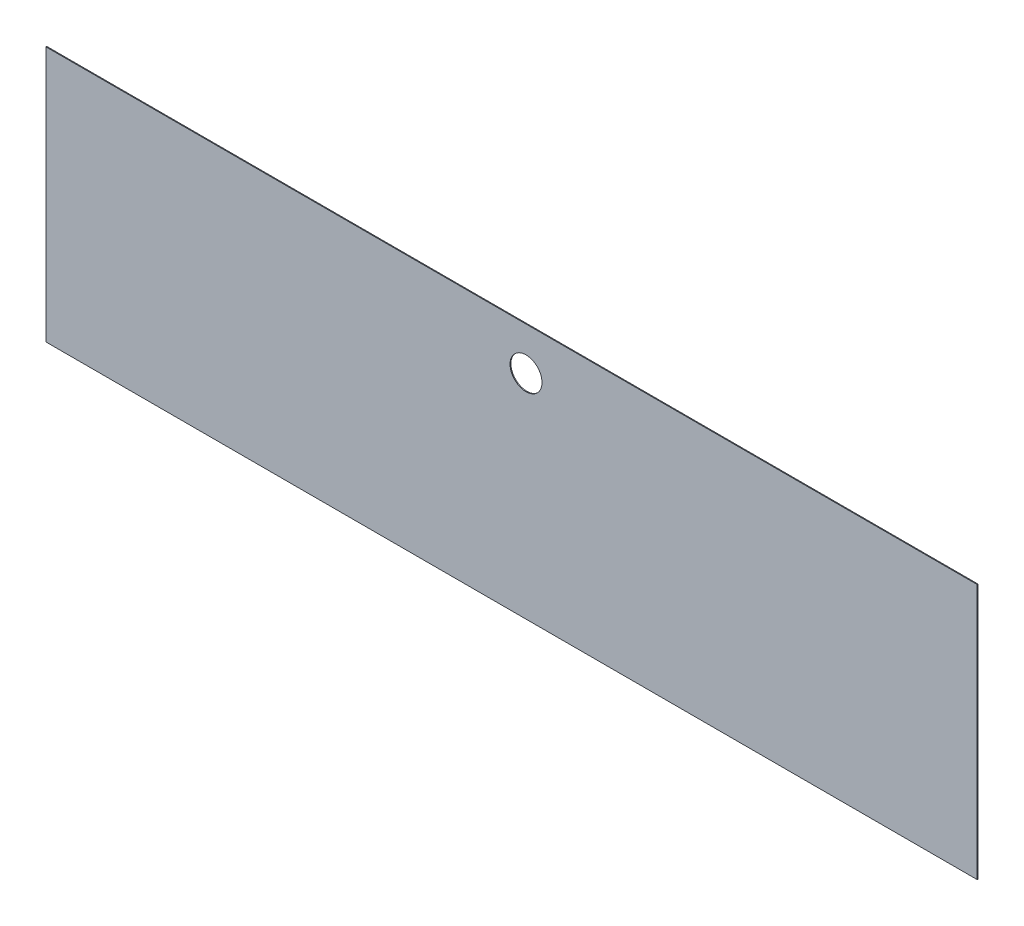
from build123d import *

# Parameters (mm, degrees)
CROQUIS1_W            = 2186
CROQUIS1_H            = 600
EXTRUIR1_DEPTH        = 2
CROQUIS2_R            = 37.5
CORTAR_EXTRUIR1_DEPTH = 10


with BuildPart() as part:
    # Croquis1 → Extruir1 (new body)
    with BuildSketch(Plane.XY):
        Rectangle(CROQUIS1_W, CROQUIS1_H)
    extrude(amount=EXTRUIR1_DEPTH)

    # Croquis2 → Cortar-Extruir1 (cut)
    with BuildSketch(Plane(origin=(0, 0, 0), x_dir=(-1, 0, 0), z_dir=(0, 0, -1))):
        with Locations((-33.925885806, 199.774015156)):
            Circle(CROQUIS2_R)
    extrude(amount=-CORTAR_EXTRUIR1_DEPTH, mode=Mode.SUBTRACT)


solid = part.part
